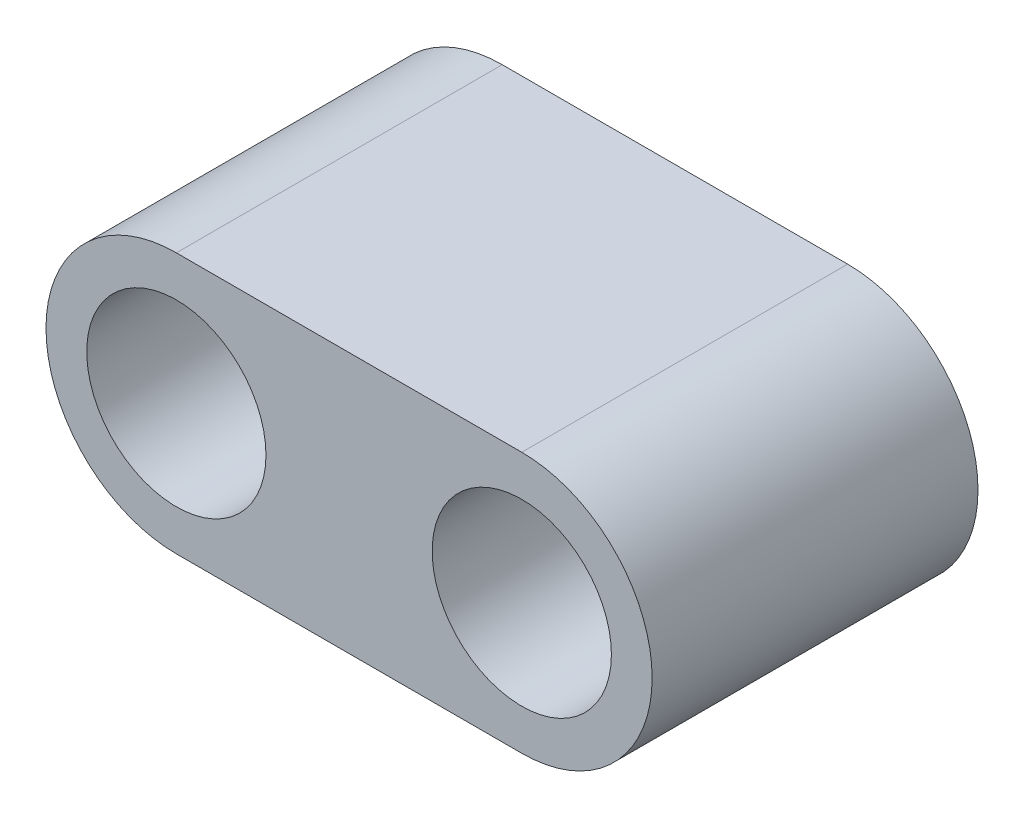
from build123d import *

# Parameters (mm, degrees)
BOSS_EXTRUDE1_DEPTH = 25
SKETCH2_R           = 6.875
CUT_EXTRUDE1_DEPTH  = 49.551519029


with BuildPart() as part:
    # Sketch1 → Boss-Extrude1 (new body)
    with BuildSketch(Plane.XY):
        with BuildLine():
            Line((0, 0), (26.5, 0))
            ThreePointArc((26.5, 0), (36.5, -10), (26.5, -20))
            Line((26.5, -20), (0, -20))
            ThreePointArc((0, -20), (-10, -10), (0, 0))
        make_face()
    extrude(amount=BOSS_EXTRUDE1_DEPTH)

    # Sketch2 → Cut-Extrude1 (cut, through all)
    with BuildSketch(Plane.XY.offset(25)):
        with Locations((0, -10)):
            Circle(SKETCH2_R)
        with Locations((26.5, -10)):
            Circle(SKETCH2_R)
    extrude(amount=-CUT_EXTRUDE1_DEPTH, mode=Mode.SUBTRACT)


solid = part.part
